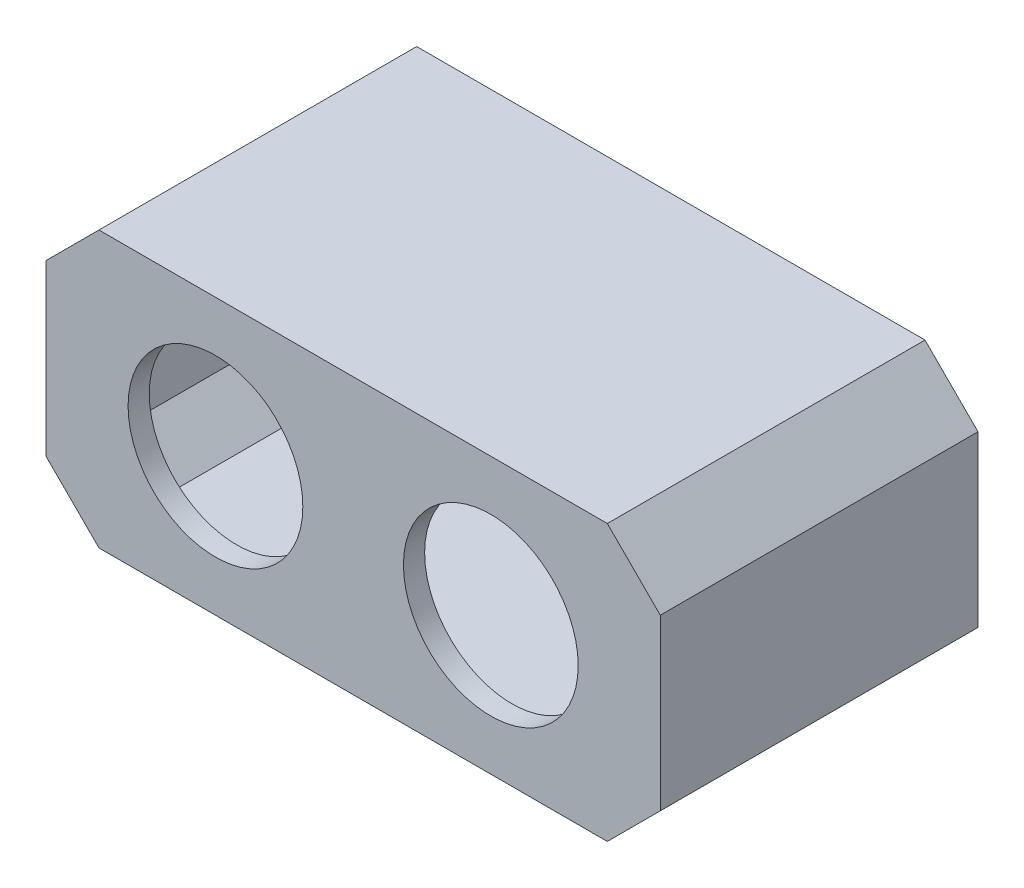
from build123d import *

# Parameters (mm, degrees)
SKETCH1_W          = 58
SKETCH1_H          = 26
SKULL_BLOCK_DEPTH  = 30
SKULL_CHAMFER_SIZE = 5
HOLLOW_SKULL_T     = -2
EYE_HOLE_REACH     = 45.704
SKETCH2_R          = 8.25
SKETCH3_R          = 12
NECK_MOUNT_DEPTH   = 1


with BuildPart() as part:
    # Sketch1 → skull block (new body)
    with BuildSketch(Plane.XY):
        Rectangle(SKETCH1_W, SKETCH1_H)
    extrude(amount=-SKULL_BLOCK_DEPTH)

    # skull chamfer
    skull_chamfer_edges = [part.edges().sort_by_distance(p)[0] for p in [
        (29, -13, -15),
        (-29, -13, -15),
        (-29, 13, -15),
        (29, 13, -15),
    ]]
    chamfer(skull_chamfer_edges, length=SKULL_CHAMFER_SIZE)

    # hollow skull
    hollow_skull_openings = [part.faces().sort_by_distance(p)[0] for p in [
        (0, 0, -30),
    ]]
    offset(amount=HOLLOW_SKULL_T, openings=hollow_skull_openings, kind=Kind.INTERSECTION)

    # Sketch2 → eye hole (cut, up to next)
    with BuildSketch(Plane.XY, mode=Mode.PRIVATE) as eye_hole_sk1:
        with Locations((13, 0)):
            Circle(SKETCH2_R)
    eye_hole_tool1 = extrude(eye_hole_sk1.sketch, amount=-EYE_HOLE_REACH, mode=Mode.PRIVATE) & part.part
    eye_hole = eye_hole_tool1.solids().sort_by_distance((13, 0, 0))[0]
    add(eye_hole, mode=Mode.SUBTRACT)

    # mirror eye hole: eye hole across plane
    add(eye_hole.mirror(Plane(origin=(0, 0, 0), x_dir=(0, 0, 1), z_dir=(1, 0, 0))), mode=Mode.SUBTRACT)

    # Sketch3 → neck mount (cut)
    with BuildSketch(Plane.XZ.offset(13)):
        with Locations(Location((0, -15, 0), (0, 0, 270))):
            Circle(SKETCH3_R)
    extrude(amount=-NECK_MOUNT_DEPTH, mode=Mode.SUBTRACT)


solid = part.part
